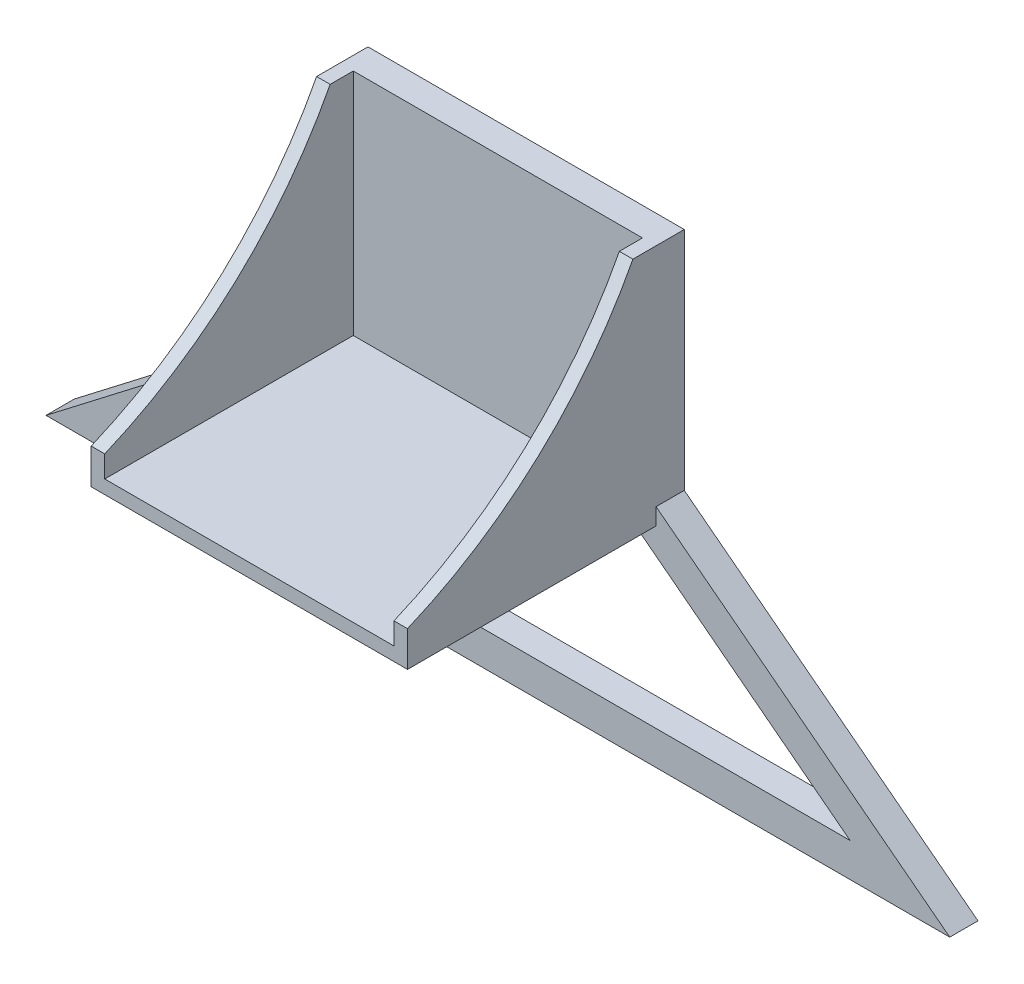
from build123d import *

# Parameters (mm, degrees)
BOSS_EXTRUDE5_DEPTH     = 2.5
BOSS_EXTRUDE6_DEPTH     = 22
CUT_EXTRUDE2_DEPTH      = 72.527966559
CUT_EXTRUDE2_DEPTH_BACK = 72.527966559
SKETCH7_R               = 40


with BuildPart() as part:
    # Sketch2 → Boss-Extrude5 (new body)
    with BuildSketch(Plane.XY):
        Polygon((-14, 0), (14, 0), (14, -20), (40, -40), (-40, -40), (-14, -20), align=None)
        Polygon((-11, -21.477204492), (-31.17963416, -37), (31.17963416, -37), (11, -21.477204492), align=None, mode=Mode.SUBTRACT)
    extrude(amount=BOSS_EXTRUDE5_DEPTH)

    # Sketch6 → Boss-Extrude6 (add)
    with BuildSketch(Plane.XY.offset(2.5)):
        Polygon((-12.8, 0), (-14, 0), (-14, -21.477204492), (14, -21.477204492), (14, 0), (12.8, 0), (12.8, -20.277204492), (-12.8, -20.277204492), align=None)
    extrude(amount=BOSS_EXTRUDE6_DEPTH)

    # Sketch7 → Cut-Extrude2 (cut, two sides: drawn at the far end of the back side and taken through both)
    with BuildSketch(Plane.ZY.offset(14).offset(-CUT_EXTRUDE2_DEPTH_BACK)):
        with Locations((40, 18.522795508)):
            Circle(SKETCH7_R)
    extrude(amount=CUT_EXTRUDE2_DEPTH + CUT_EXTRUDE2_DEPTH_BACK, mode=Mode.SUBTRACT)


solid = part.part
